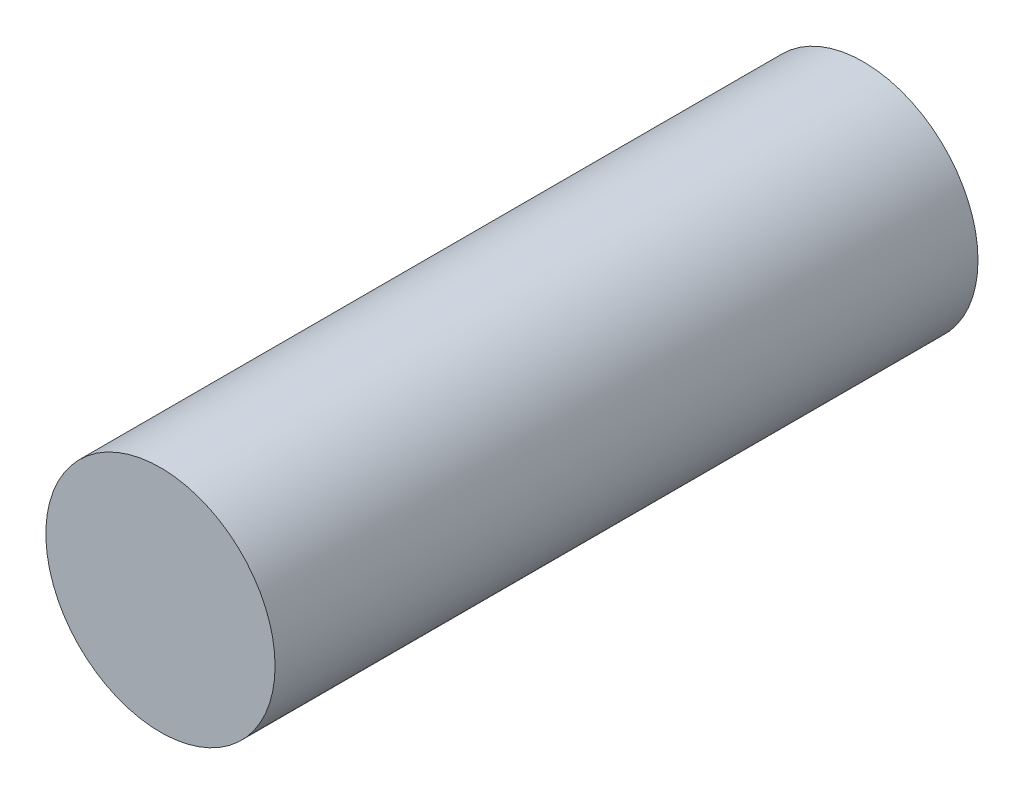
from build123d import *

# Parameters (mm, degrees)
CROQUIS1_R              = 6
SALIENTE_EXTRUIR1_DEPTH = 36.8


with BuildPart() as part:
    # Croquis1 → Saliente-Extruir1 (new body)
    with BuildSketch(Plane.XY):
        Circle(CROQUIS1_R)
    extrude(amount=SALIENTE_EXTRUIR1_DEPTH)


solid = part.part
